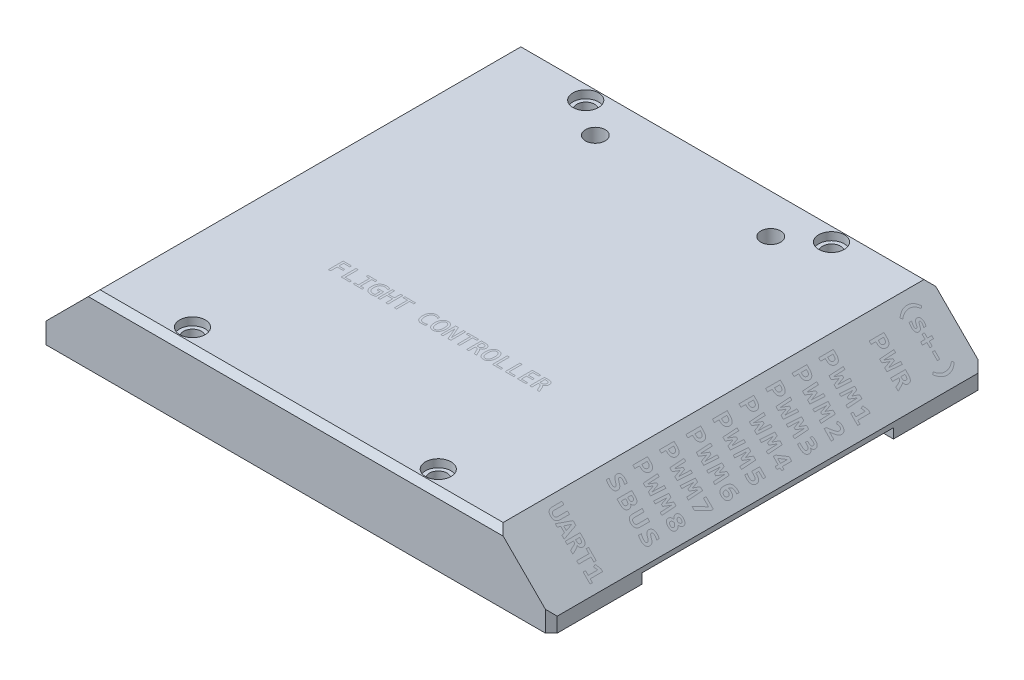
from build123d import *

# Parameters (mm, degrees)
SKETCH_1_W                     = 52
SKETCH_1_H                     = 44
EXTRUDE_1_DEPTH                = 7
SKETCH_2_W                     = 40.4
SKETCH_2_H                     = 40.4
CUT_EXTRUDE_1_DEPTH            = 5.5
SKETCH_4_W                     = 7.08
SKETCH_4_H                     = 40.4
EXTRUDE_2_DEPTH                = 1
SKETCH_5_W                     = 5.8
SKETCH_5_H                     = 25.6
CUT_EXTRUDE_2_DEPTH            = 1
SKETCH_7_R                     = 1
CUT_EXTRUDE_3_DEPTH            = 63.531991812
EXTRUDE_3_REACH                = 64.682
SKETCH_13_R                    = 1.75
HOLE_WIZARD_M1_6_1_D           = 1.8
HOLE_WIZARD_M1_6_1_CBORE_D     = 2.6
HOLE_WIZARD_M1_6_1_CBORE_DEPTH = 0.8
CHAMFER_1_SIZE                 = 5.5
CUT_EXTRUDE_4_DEPTH            = 1.6
SKETCH_15_W                    = 10
SKETCH_15_H                    = 12.713519239
CUT_EXTRUDE_5_DEPTH            = 5
CHAMFER_2_SIZE                 = 0.6
FILLET_1_R                     = 1
SKETCH_19_R                    = 0.9
CUT_EXTRUDE_9_DEPTH            = 1.6


with BuildPart() as part:
    # 스케치1 → 보스-돌출1 (new body)
    with BuildSketch(Plane(origin=(0, 7, 0), x_dir=(1, 0, 0), z_dir=(0, 1, 0))):
        with Locations((20, 20)):
            Rectangle(SKETCH_1_W, SKETCH_1_H)
    extrude(amount=-EXTRUDE_1_DEPTH)

    # 스케치2 → 컷-돌출1 (cut)
    with BuildSketch(Plane.XZ):
        with Locations((20, -20)):
            Rectangle(SKETCH_2_W, SKETCH_2_H)
    extrude(amount=-CUT_EXTRUDE_1_DEPTH, mode=Mode.SUBTRACT)

    # 스케치4 → 보스-돌출2 (add)
    # profile 1 of 2: a face of its own
    with BuildSketch(Plane.XZ.offset(-5.5)):
        with Locations((3.34, -20)):
            Rectangle(SKETCH_4_W, SKETCH_4_H)
        with BuildLine():
            Line((4.64, -5), (4.64, -15))
            ThreePointArc((4.64, -15), (3.34, -16.3), (2.04, -15))
            Line((2.04, -15), (2.04, -5))
            ThreePointArc((2.04, -5), (3.34, -3.7), (4.64, -5))
        make_face(mode=Mode.SUBTRACT)
        with BuildLine():
            Line((4.64, -25), (4.64, -35))
            ThreePointArc((4.64, -35), (3.34, -36.3), (2.04, -35))
            Line((2.04, -35), (2.04, -25))
            ThreePointArc((2.04, -25), (3.34, -23.7), (4.64, -25))
        make_face(mode=Mode.SUBTRACT)
    # profile 2 of 2: a face of its own
    with BuildSketch(Plane.XZ.offset(-5.5)):
        with Locations((36.66, -20)):
            Rectangle(SKETCH_4_W, SKETCH_4_H)
        with BuildLine():
            Line((37.96, -5), (37.96, -15))
            ThreePointArc((37.96, -15), (36.66, -16.3), (35.36, -15))
            Line((35.36, -15), (35.36, -5))
            ThreePointArc((35.36, -5), (36.66, -3.7), (37.96, -5))
        make_face(mode=Mode.SUBTRACT)
        with BuildLine():
            Line((35.36, -35), (35.36, -25))
            ThreePointArc((35.36, -25), (36.66, -23.7), (37.96, -25))
            Line((37.96, -25), (37.96, -35))
            ThreePointArc((37.96, -35), (36.66, -36.3), (35.36, -35))
        make_face(mode=Mode.SUBTRACT)
    extrude(amount=EXTRUDE_2_DEPTH)

    # 스케치5 → 컷-돌출2 (cut)
    with BuildSketch(Plane.XZ):
        with Locations((43.1, -20)):
            Rectangle(SKETCH_5_W, SKETCH_5_H)
        with Locations((-3.1, -20)):
            Rectangle(SKETCH_5_W, SKETCH_5_H)
    extrude(amount=-CUT_EXTRUDE_2_DEPTH, mode=Mode.SUBTRACT)

    # 스케치7 → 컷-돌출3 (cut, through all)
    with BuildSketch(Plane.XZ.offset(-5.5)):
        with Locations(Location((28.92, -37.4, 0), (0, 0, 270))):
            Circle(SKETCH_7_R)
        with Locations(Location((11.08, -37.4, 0), (0, 0, 270))):
            Circle(SKETCH_7_R)
    extrude(amount=-CUT_EXTRUDE_3_DEPTH, mode=Mode.SUBTRACT)

    # 스케치13 → 보스-돌출3 (add, up to next)
    with BuildSketch(Plane.XZ, mode=Mode.PRIVATE) as extrude_3_sk1:
        with Locations((7.5, 0)):
            Circle(SKETCH_13_R)
    extrude_3_tool1 = extrude(extrude_3_sk1.sketch, amount=-EXTRUDE_3_REACH, mode=Mode.PRIVATE) - part.part
    # 스케치13 → 보스-돌출3 (add, up to next)
    with BuildSketch(Plane.XZ, mode=Mode.PRIVATE) as extrude_3_sk2:
        with Locations((32.5, 0)):
            Circle(SKETCH_13_R)
    extrude_3_tool2 = extrude(extrude_3_sk2.sketch, amount=-EXTRUDE_3_REACH, mode=Mode.PRIVATE) - part.part
    # 스케치13 → 보스-돌출3 (add, up to next)
    with BuildSketch(Plane.XZ, mode=Mode.PRIVATE) as extrude_3_sk3:
        with Locations((32.5, -40)):
            Circle(SKETCH_13_R)
    extrude_3_tool3 = extrude(extrude_3_sk3.sketch, amount=-EXTRUDE_3_REACH, mode=Mode.PRIVATE) - part.part
    # 스케치13 → 보스-돌출3 (add, up to next)
    with BuildSketch(Plane.XZ, mode=Mode.PRIVATE) as extrude_3_sk4:
        with Locations((7.5, -40)):
            Circle(SKETCH_13_R)
    extrude_3_tool4 = extrude(extrude_3_sk4.sketch, amount=-EXTRUDE_3_REACH, mode=Mode.PRIVATE) - part.part
    add(extrude_3_tool1.solids().sort_by_distance((7.5, 0, 0))[0])
    add(extrude_3_tool2.solids().sort_by_distance((32.5, 0, 0))[0])
    add(extrude_3_tool3.solids().sort_by_distance((32.5, 0, -40))[0])
    add(extrude_3_tool4.solids().sort_by_distance((7.5, 0, -40))[0])

    # M1.6 남비 머리 나사용 카운터보어1 (through all)
    with Locations(Plane(origin=(0, 7, 0), x_dir=(1, 0, 0), z_dir=(0, 1, 0))):
        with Locations((7.5, 0), (32.5, 0), (7.5, 40), (32.5, 40)):
            CounterBoreHole(HOLE_WIZARD_M1_6_1_D / 2, HOLE_WIZARD_M1_6_1_CBORE_D / 2, HOLE_WIZARD_M1_6_1_CBORE_DEPTH)

    # 모따기1
    chamfer_1_edges = [part.edges().sort_by_distance(p)[0] for p in [
        (46, 7, -20),
        (-6, 7, -20),
    ]]
    chamfer(chamfer_1_edges, length=CHAMFER_1_SIZE)

    # 스케치14 → 컷-돌출4 (cut)
    with BuildSketch(Plane.XZ):
        with BuildLine():
            Line((34.238533865, 0.2), (30.761466135, 0.2))
            ThreePointArc((30.761466135, 0.2), (32.5, -1.75), (34.238533865, 0.2))
        make_face()
        with BuildLine():
            Line((9.238533865, 0.2), (5.761466135, 0.2))
            ThreePointArc((5.761466135, 0.2), (7.5, -1.75), (9.238533865, 0.2))
        make_face()
        with BuildLine():
            Line((9.238533865, -40.2), (5.761466135, -40.2))
            ThreePointArc((5.761466135, -40.2), (7.5, -38.25), (9.238533865, -40.2))
        make_face()
        with BuildLine():
            Line((34.238533865, -40.2), (30.761466135, -40.2))
            ThreePointArc((30.761466135, -40.2), (32.5, -38.25), (34.238533865, -40.2))
        make_face()
    extrude(amount=-CUT_EXTRUDE_4_DEPTH, mode=Mode.SUBTRACT)

    # 스케치15 → 컷-돌출5 (cut)
    with BuildSketch(Plane.XZ):
        with Locations((20, -41.191132848)):
            Rectangle(SKETCH_15_W, SKETCH_15_H)
    extrude(amount=-CUT_EXTRUDE_5_DEPTH, mode=Mode.SUBTRACT)

    # 모따기2
    chamfer_2_edges = [part.edges().sort_by_distance(p)[0] for p in [
        (46, 0.75, 2),
        (46, 0.75, -42),
        (-6, 0.75, -42),
        (20, 7, 2),
        (20, 7, -42),
        (-6, 0.75, 2),
    ]]
    chamfer(chamfer_2_edges, length=CHAMFER_2_SIZE)

    # 필렛1
    fillet_1_edges = [part.edges().sort_by_distance(p)[0] for p in [
        (6.88, 5, -1.636490147),
        (9.238533865, 3.55, 0.2),
        (34.238533865, 3.05, 0.2),
        (33.12, 5, -1.636490147),
        (33.12, 5, -38.363509853),
        (30.761466135, 3.55, -40.2),
        (6.88, 5, -38.363509853),
        (5.761466135, 3.05, -40.2),
        (34.238533865, 3.05, -40.2),
        (9.238533865, 3.55, -40.2),
        (30.761466135, 3.55, 0.2),
        (5.761466135, 3.05, 0.2),
        (-0.2, 2.25, -40.2),
        (-0.2, 2.25, 0.2),
        (40.2, 2.25, -40.2),
        (40.2, 2.25, 0.2),
    ]]
    fillet(fillet_1_edges, radius=FILLET_1_R)

    # 스케치19 → 컷-돌출9 (cut)
    with BuildSketch(Plane.XZ):
        with Locations((-0.2, -40.2)):
            Circle(SKETCH_19_R)
        with Locations((-0.2, 0.2)):
            Circle(SKETCH_19_R)
        with Locations((40.2, 0.2)):
            Circle(SKETCH_19_R)
        with Locations((40.2, -40.2)):
            Circle(SKETCH_19_R)
    extrude(amount=-CUT_EXTRUDE_9_DEPTH, mode=Mode.SUBTRACT)


solid = part.part
